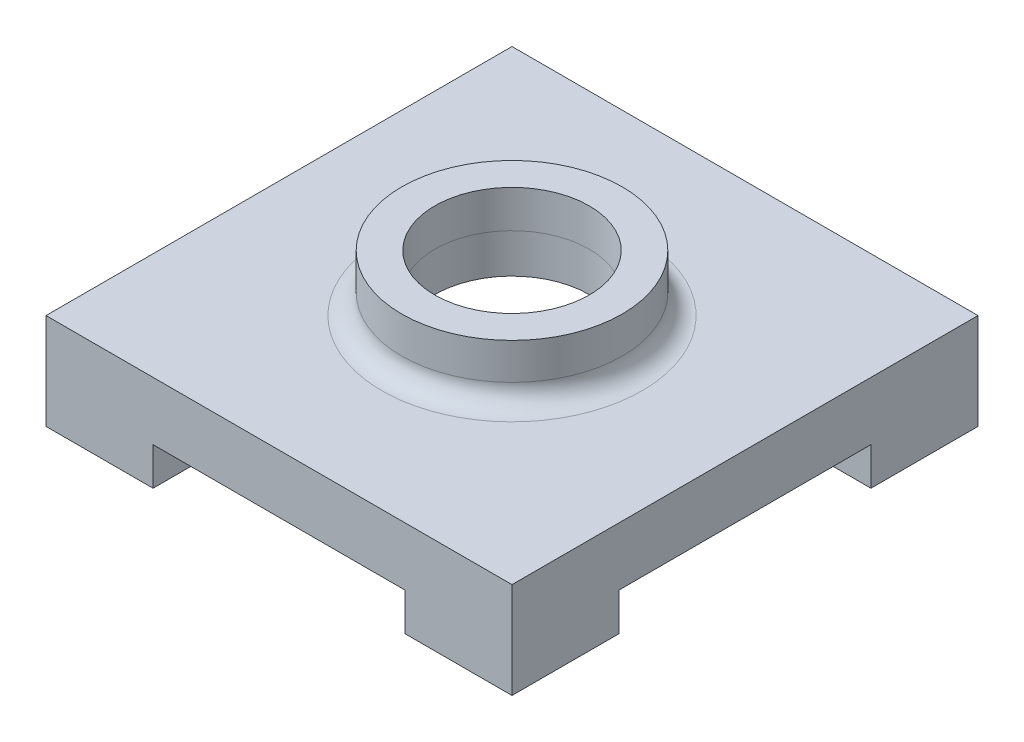
from build123d import *

# Parameters (mm, degrees)
OUTLINE_DEPTH        = 40
OUTLINE_DEPTH_BACK   = 40
SKETCH1_W            = 18.25
SKETCH1_H            = 40
SKETCH2_W            = 40
SKETCH2_H            = 80
EXTRUSION15_DEPTH    = 6
CAMERA_MOUNT_D       = 24.5364
SKETCH5_R            = 17.5
SKETCH5_R_2          = 12.268
EXTRUSION19_DEPTH    = 5.9562
CUT_EXTRUDE1_START   = -3
SKETCH10_W           = 80
SKETCH10_H           = 80
SKETCH10_R           = 17.5
CUT_EXTRUDE1_DEPTH   = 3
SKETCH6_W            = 80
SKETCH6_H            = 40
EXTRUSION21_DEPTH    = 6
SKETCH7_W            = 60
SKETCH7_H            = 60
EXTRUSION22_DEPTH    = 9
FILLET4_R            = 3.175
HOLE7_D              = 3.3
HOLE7_DEPTH          = 12
HOLE7_TIP            = 0.991420021
SKETCH11_OUTSIDE_W   = 105.14
SKETCH11_OUTSIDE_H   = 105.14
SKETCH11_OUTSIDE_W_2 = 74
SKETCH11_OUTSIDE_H_2 = 74
CUT_EXTRUDE2_DEPTH   = 59.588074725
CUT_EXTRUDE3_START   = -3
CUT_EXTRUDE3_DEPTH   = 3


with BuildPart() as part:
    # Sketch1 → Outline (new, two sides: drawn at the far end of the back side and taken through both)
    with BuildSketch(Plane.YZ.offset(-OUTLINE_DEPTH_BACK)):
        Polygon((18.25, 40), (5.33, 40), (0, 40), (0, 0), (18.25, 0), align=None)
        with Locations((9.125, -20)):
            Rectangle(SKETCH1_W, SKETCH1_H)
    extrude(amount=OUTLINE_DEPTH + OUTLINE_DEPTH_BACK)

    # Sketch2 → Extrusion15 (cut)
    with BuildSketch(Plane.XZ):
        Rectangle(SKETCH2_W, SKETCH2_H)
    extrude(amount=-EXTRUSION15_DEPTH, mode=Mode.SUBTRACT)

    # Camera mount (through all)
    with Locations(Plane(origin=(0, 18.25, 0), x_dir=(1, 0, 0), z_dir=(0, 1, 0))):
        with Locations((0, 0)):
            Hole(CAMERA_MOUNT_D / 2)

    # Sketch5 → Extrusion19 (add)
    with BuildSketch(Plane(origin=(0, 18.25, 0), x_dir=(-1, 0, 0), z_dir=(0, 1, 0))):
        with Locations(Location((0, 0, 0), (0, 0, 90))):
            Circle(SKETCH5_R)
        with Locations(Location((0, 0, 0), (0, 0, 90))):
            Circle(SKETCH5_R_2, mode=Mode.SUBTRACT)
    extrude(amount=EXTRUSION19_DEPTH)

    # Sketch10 → Cut-Extrude1 (cut)
    with BuildSketch(Plane(origin=(0, 18.25, 0), x_dir=(1, 0, 0), z_dir=(0, 1, 0)).offset(CUT_EXTRUDE1_START)):
        Rectangle(SKETCH10_W, SKETCH10_H)
        with Locations(Location((0, 0, 0), (0, 0, 270))):
            Circle(SKETCH10_R, mode=Mode.SUBTRACT)
    extrude(amount=CUT_EXTRUDE1_DEPTH, mode=Mode.SUBTRACT)

    # Sketch6 → Extrusion21 (cut)
    with BuildSketch(Plane.XZ):
        Rectangle(SKETCH6_W, SKETCH6_H)
    extrude(amount=-EXTRUSION21_DEPTH, mode=Mode.SUBTRACT)

    # Sketch7 → Extrusion22 (cut)
    with BuildSketch(Plane.XZ):
        Rectangle(SKETCH7_W, SKETCH7_H)
    extrude(amount=-EXTRUSION22_DEPTH, mode=Mode.SUBTRACT)

    # Fillet4
    fillet4_edges = [part.edges().sort_by_distance(p)[0] for p in [
        (-30, 4.5, 30),
        (30, 4.5, -30),
        (30, 4.5, 30),
        (-30, 4.5, -30),
        (0, 15.25, -17.5),
    ]]
    fillet(fillet4_edges, radius=FILLET4_R)

    # Hole7
    with Locations(Plane(origin=(0, 0, 0), x_dir=(-1, 0, 0), z_dir=(0, -1, 0))):
        with Locations((32.5, 32.5), (-32.5, 32.5), (-32.5, -32.5), (32.5, -32.5)):
            Hole(HOLE7_D / 2, depth=HOLE7_DEPTH)
            with Locations((0, 0, -(HOLE7_DEPTH + HOLE7_TIP / 2))):  # 118° drill point
                Cone(0, HOLE7_D / 2, HOLE7_TIP, mode=Mode.SUBTRACT)

    # Sketch11 outside → Cut-Extrude2 (cut, through all)
    with BuildSketch(Plane(origin=(0, 15.25, 0), x_dir=(1, 0, 0), z_dir=(0, 1, 0))):
        Rectangle(SKETCH11_OUTSIDE_W, SKETCH11_OUTSIDE_H)
        Rectangle(SKETCH11_OUTSIDE_W_2, SKETCH11_OUTSIDE_H_2, mode=Mode.SUBTRACT)
    extrude(amount=-CUT_EXTRUDE2_DEPTH, mode=Mode.SUBTRACT)

    # Sketch13 → Cut-Extrude3 (cut)
    with BuildSketch(Plane.XZ.offset(-9).offset(CUT_EXTRUDE3_START)):
        with BuildLine():
            Line((26.825, 30), (-26.825, 30))
            ThreePointArc((-26.825, 30), (-29.07006403, 29.07006403), (-30, 26.825))
            Line((-30, 26.825), (-30, -26.825))
            ThreePointArc((-30, -26.825), (-29.07006403, -29.07006403), (-26.825, -30))
            Line((-26.825, -30), (26.825, -30))
            ThreePointArc((26.825, -30), (29.07006403, -29.07006403), (30, -26.825))
            Line((30, -26.825), (30, 26.825))
            ThreePointArc((30, 26.825), (29.07006403, 29.07006403), (26.825, 30))
        make_face()
    extrude(amount=CUT_EXTRUDE3_DEPTH, mode=Mode.SUBTRACT)


solid = part.part
